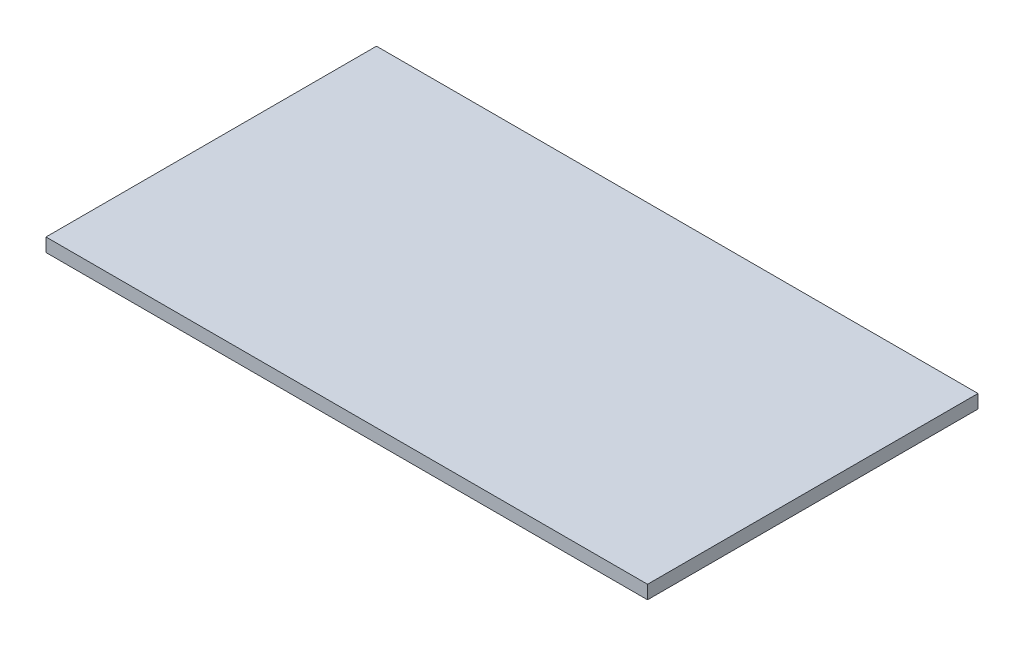
from build123d import *

# Parameters (mm, degrees)
SKETCH1_W           = 509.74752
SKETCH1_H           = 280.0477
BOSS_EXTRUDE1_DEPTH = 11.43


with BuildPart() as part:
    # Sketch1 → Boss-Extrude1 (new body)
    with BuildSketch(Plane(origin=(0, 0, 0), x_dir=(1, 0, 0), z_dir=(0, 1, 0))):
        with Locations((-100.108024585, -103.106717707)):
            Rectangle(SKETCH1_W, SKETCH1_H)
    extrude(amount=BOSS_EXTRUDE1_DEPTH)


solid = part.part
